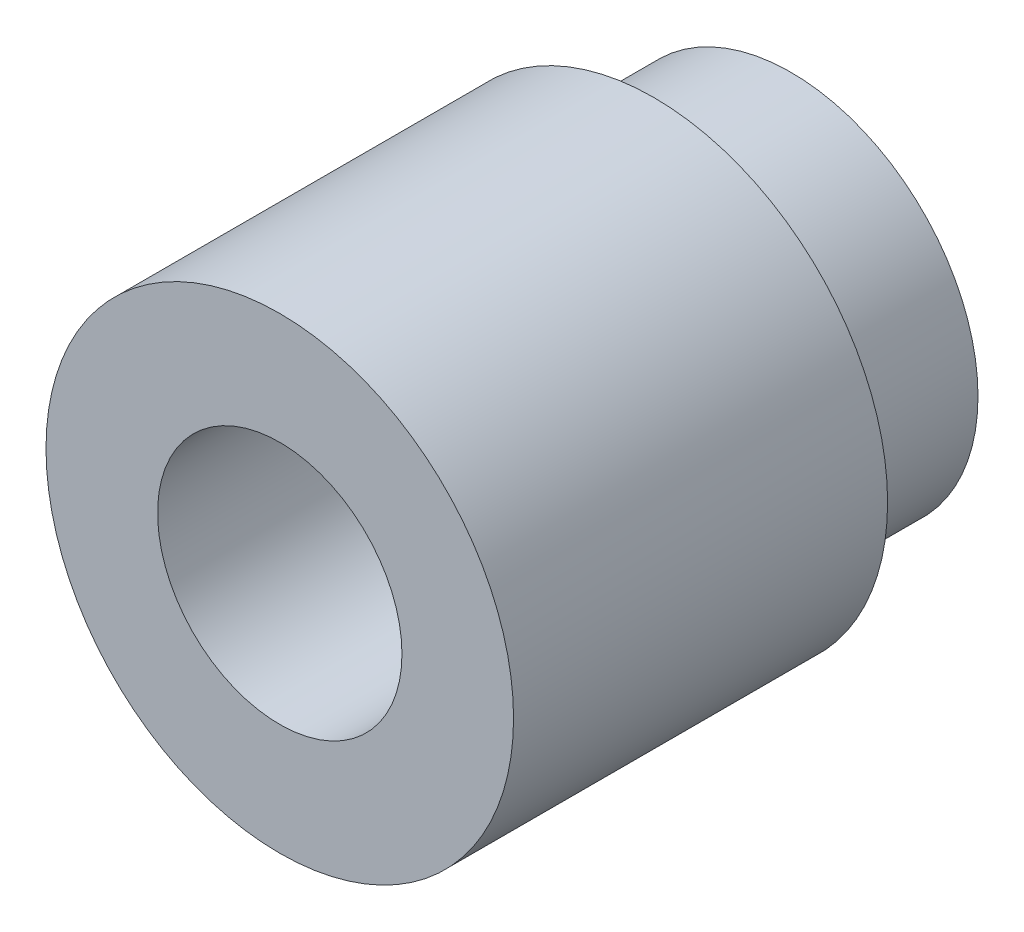
from build123d import *


with BuildPart() as part:
    # Sketch1 → Revolve1 (revolve)
    with BuildSketch(Plane(origin=(0, 0, 0), x_dir=(0, 0, -1), z_dir=(1, 0, 0)), mode=Mode.PRIVATE) as revolve1_sk:
        Polygon((0, 2.4892), (10.414, 2.4892), (10.414, 3.81), (7.62, 3.81), (7.62, 4.7625), (0, 4.7625), align=None)
    revolve(revolve1_sk.sketch.rotate(Axis((0, 0, 10.877893224), (0, 0, -1)), 90), axis=Axis((0, 0, 10.877893224), (0, 0, -1)))


solid = part.part
